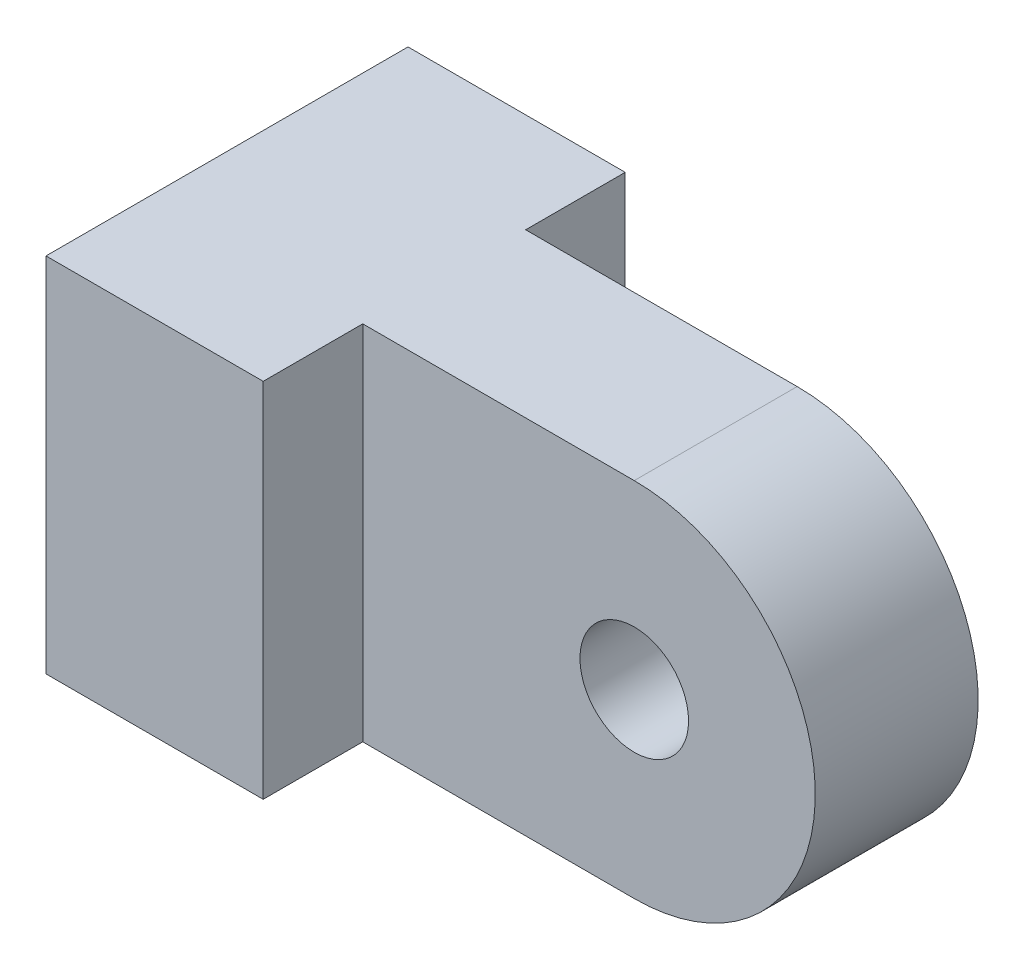
from build123d import *

# Parameters (mm, degrees)
SKETCH_1_W           = 20
SKETCH_1_H           = 20
SKETCH_1_R           = 7.5
EXTRUDE_1_DEPTH      = 10
EXTRUDE_2_DEPTH      = 0.0001
EXTRUDE_2_DEPTH_BACK = 10
SKETCH_2_W           = 5
SKETCH_2_H           = 2
SKETCH_3_R           = 1.5
CUT_EXTRUDE_1_DEPTH  = 27.925861175
SKETCH_4_W           = 20
SKETCH_4_H           = 20
EXTRUDE_3_DEPTH      = 2
SKETCH_5_W           = 9
SKETCH_5_H           = 20
EXTRUDE_4_DEPTH      = 25
SKETCH_7_R           = 3
CUT_EXTRUDE_2_DEPTH  = 10
CUT_EXTRUDE_3_DEPTH  = 10
SKETCH_9_W           = 10.0001
SKETCH_9_H           = 5
CUT_EXTRUDE_4_DEPTH  = 45.654227124


with BuildPart() as part:
    # 草图1 → 凸台-拉伸1 (new body)
    with BuildSketch(Plane(origin=(0, 0, 0), x_dir=(0, 0, -1), z_dir=(1, 0, 0))):
        Rectangle(SKETCH_1_W, SKETCH_1_H)
        Circle(SKETCH_1_R, mode=Mode.SUBTRACT)
    extrude(amount=EXTRUDE_1_DEPTH)

    # 草图2 → 凸台-拉伸2 (add, two sides: drawn at the far end of the back side and taken through both)
    with BuildSketch(Plane(origin=(10, 0, 0), x_dir=(0, 0, -1), z_dir=(1, 0, 0)).offset(-EXTRUDE_2_DEPTH_BACK)):
        with Locations((-12.5, 9)):
            Rectangle(SKETCH_2_W, SKETCH_2_H)
        with Locations((-12.5, -9)):
            Rectangle(SKETCH_2_W, SKETCH_2_H)
        with Locations((12.5, -9)):
            Rectangle(SKETCH_2_W, SKETCH_2_H)
        with Locations((12.5, 9)):
            Rectangle(SKETCH_2_W, SKETCH_2_H)
    extrude(amount=EXTRUDE_2_DEPTH + EXTRUDE_2_DEPTH_BACK)

    # 草图3 → 切除-拉伸1 (cut, through all)
    with BuildSketch(Plane(origin=(0, 10, 0), x_dir=(1, 0, 0), z_dir=(0, 1, 0))):
        with Locations(Location((5.00005, 12.5, 0), (0, 0, 270))):
            Circle(SKETCH_3_R)
        with Locations(Location((5.00005, -12.5, 0), (0, 0, 270))):
            Circle(SKETCH_3_R)
    extrude(amount=-CUT_EXTRUDE_1_DEPTH, mode=Mode.SUBTRACT)

    # 草图4 → 凸台-拉伸3 (add)
    with BuildSketch(Plane(origin=(10, 0, 0), x_dir=(0, 0, -1), z_dir=(1, 0, 0))):
        Rectangle(SKETCH_4_W, SKETCH_4_H)
    extrude(amount=EXTRUDE_3_DEPTH)

    # 草图5 → 凸台-拉伸4 (add)
    with BuildSketch(Plane(origin=(12, 0, 0), x_dir=(0, 0, -1), z_dir=(1, 0, 0))):
        Rectangle(SKETCH_5_W, SKETCH_5_H)
    extrude(amount=EXTRUDE_4_DEPTH)

    # 草图7 → 切除-拉伸2 (cut)
    with BuildSketch(Plane(origin=(0, 0, -4.5), x_dir=(-1, 0, 0), z_dir=(0, 0, -1))):
        with Locations((-27, 0)):
            Circle(SKETCH_7_R)
    extrude(amount=-CUT_EXTRUDE_2_DEPTH, mode=Mode.SUBTRACT)

    # 草图8 → 切除-拉伸3 (cut)
    with BuildSketch(Plane(origin=(0, 0, -4.5), x_dir=(-1, 0, 0), z_dir=(0, 0, -1))):
        with BuildLine():
            Line((-37, -10), (-27, -10))
            ThreePointArc((-27, -10), (-34.071067812, -7.071067812), (-37, 0))
            Line((-37, 0), (-37, -10))
        make_face()
        with BuildLine():
            Line((-37, 10), (-37, 0))
            ThreePointArc((-37, 0), (-34.071067812, 7.071067812), (-27, 10))
            Line((-27, 10), (-37, 10))
        make_face()
    extrude(amount=-CUT_EXTRUDE_3_DEPTH, mode=Mode.SUBTRACT)

    # 草图9 → 切除-拉伸4 (cut, through all)
    with BuildSketch(Plane.XZ.offset(10)):
        with Locations((5.00005, -12.5)):
            Rectangle(SKETCH_9_W, SKETCH_9_H)
        with Locations((5.00005, 12.5)):
            Rectangle(SKETCH_9_W, SKETCH_9_H)
    extrude(amount=-CUT_EXTRUDE_4_DEPTH, mode=Mode.SUBTRACT)


solid = part.part
